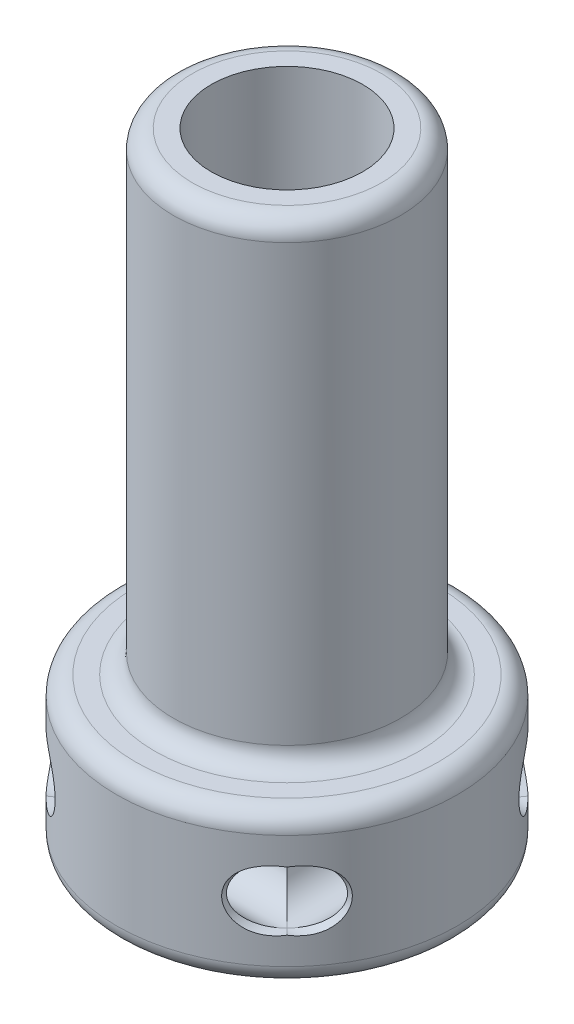
from build123d import *

# Parameters (mm, degrees)
SKETCH_1_R               = 6
SKETCH_1_R_2             = 4
EXTRUDE_1_DEPTH          = 30
EXTRUDE_2_DEPTH          = 3
EXTRUDE_2_DEPTH_BACK     = 5
SKETCH_2_R               = 9
CUT_EXTRUDE_1_DEPTH      = 33.588341474
CUT_EXTRUDE_1_DEPTH_BACK = 33.588341474
SKETCH_3_R               = 1.6
CUT_EXTRUDE_2_DEPTH      = 33.588341529
CUT_EXTRUDE_2_DEPTH_BACK = 33.588341529
SKETCH_4_R               = 1.6
FILLET_1_R               = 1


with BuildPart() as part:
    # 草图1 → 凸台-拉伸1 (new body)
    with BuildSketch(Plane(origin=(0, 0, 0), x_dir=(1, 0, 0), z_dir=(0, 1, 0))):
        with Locations(Location((0, 0, 0), (0, 0, 270))):
            Circle(SKETCH_1_R)
        with Locations(Location((0, 0, 0), (0, 0, 270))):
            Circle(SKETCH_1_R_2, mode=Mode.SUBTRACT)
    extrude(amount=EXTRUDE_1_DEPTH)

    # 草图2 → 凸台-拉伸2 (add, two sides: drawn at the far end of the back side and taken through both)
    with BuildSketch(Plane.XZ.offset(-EXTRUDE_2_DEPTH_BACK)):
        with Locations(Location((0, 0, 0), (0, 0, 270))):
            Circle(SKETCH_2_R)
    extrude(amount=EXTRUDE_2_DEPTH + EXTRUDE_2_DEPTH_BACK)

    # 草图3 → 切除-拉伸1 (cut, two sides: drawn at the far end of the back side and taken through both)
    with BuildSketch(Plane(origin=(0, 0, 0), x_dir=(0, 0, -1), z_dir=(1, 0, 0)).offset(-CUT_EXTRUDE_1_DEPTH_BACK)):
        with Locations((-6, 1)):
            Circle(SKETCH_3_R)
        with Locations((6, 1)):
            Circle(SKETCH_3_R)
    extrude(amount=CUT_EXTRUDE_1_DEPTH + CUT_EXTRUDE_1_DEPTH_BACK, mode=Mode.SUBTRACT)

    # 草图4 → 切除-拉伸2 (cut, two sides: drawn at the far end of the back side and taken through both)
    with BuildSketch(Plane.XY.offset(-CUT_EXTRUDE_2_DEPTH_BACK)):
        with Locations(Location((-6, 1, 0), (0, 0, 270))):
            Circle(SKETCH_4_R)
        with Locations(Location((6, 1, 0), (0, 0, 270))):
            Circle(SKETCH_4_R)
    extrude(amount=CUT_EXTRUDE_2_DEPTH + CUT_EXTRUDE_2_DEPTH_BACK, mode=Mode.SUBTRACT)

    # 圆角1
    fillet_1_edges = [part.edges().sort_by_distance(p)[0] for p in [
        (0, 5, -6),
        (0, 5, 9),
        (0, -3, 9),
        (0, 30, -6),
    ]]
    fillet(fillet_1_edges, radius=FILLET_1_R)


solid = part.part
